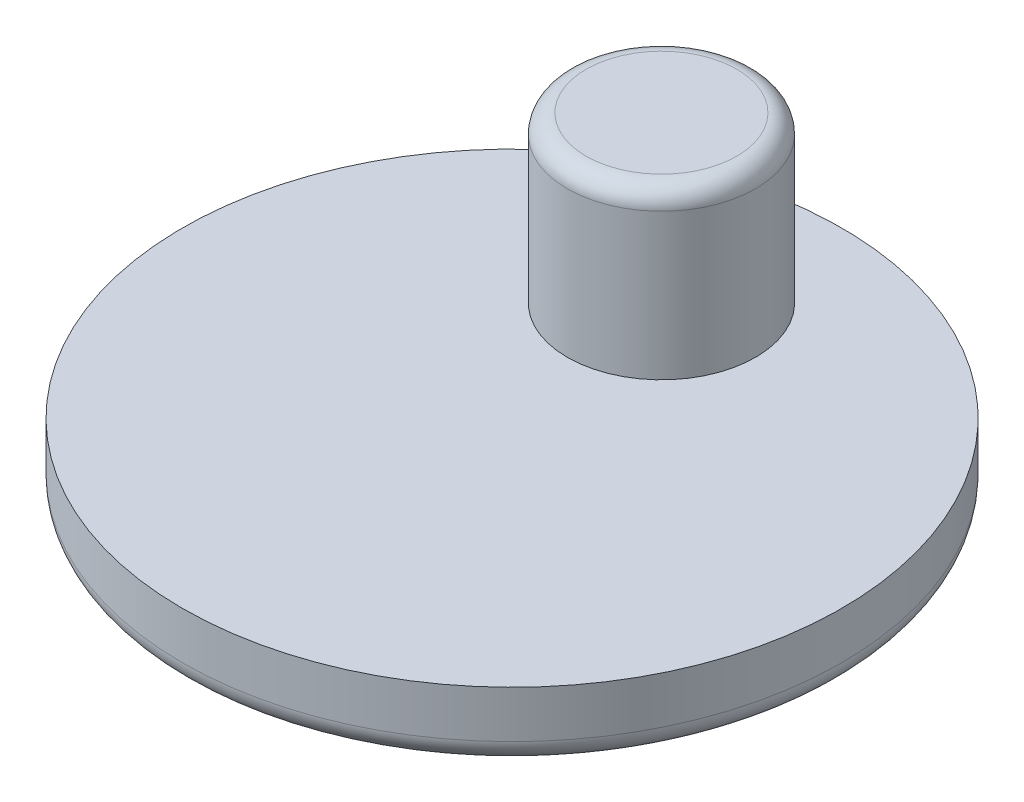
from build123d import *

# Parameters (mm, degrees)
SKETCH1_R           = 7
BOSS_EXTRUDE1_DEPTH = 1.5
SKETCH2_R           = 2
BOSS_EXTRUDE2_DEPTH = 3.5
FILLET1_R           = 0.4
FILLET2_R           = 0.5


with BuildPart() as part:
    # Sketch1 → Boss-Extrude1 (new body)
    with BuildSketch(Plane(origin=(0, 0, 0), x_dir=(1, 0, 0), z_dir=(0, 1, 0))):
        with Locations(Location((0, 0, 0), (0, 0, 270))):
            Circle(SKETCH1_R)
    extrude(amount=BOSS_EXTRUDE1_DEPTH)

    # Sketch2 → Boss-Extrude2 (add)
    with BuildSketch(Plane(origin=(-0.519161931, 1.5, -6.206869262), x_dir=(1, 0, 0), z_dir=(0, 1, 0))):
        with Locations(Location((-0.013551078, -2.501504624, 0), (0, 0, 270))):
            Circle(SKETCH2_R)
    extrude(amount=BOSS_EXTRUDE2_DEPTH)

    # Fillet1
    fillet1_edges = [part.edges().sort_by_distance(p)[0] for p in [
        (-0.532713009, 5, -5.705364637),
    ]]
    fillet(fillet1_edges, radius=FILLET1_R)

    # Fillet2
    fillet2_edges = [part.edges().sort_by_distance(p)[0] for p in [
        (0, 0, -7),
    ]]
    fillet(fillet2_edges, radius=FILLET2_R)


solid = part.part
